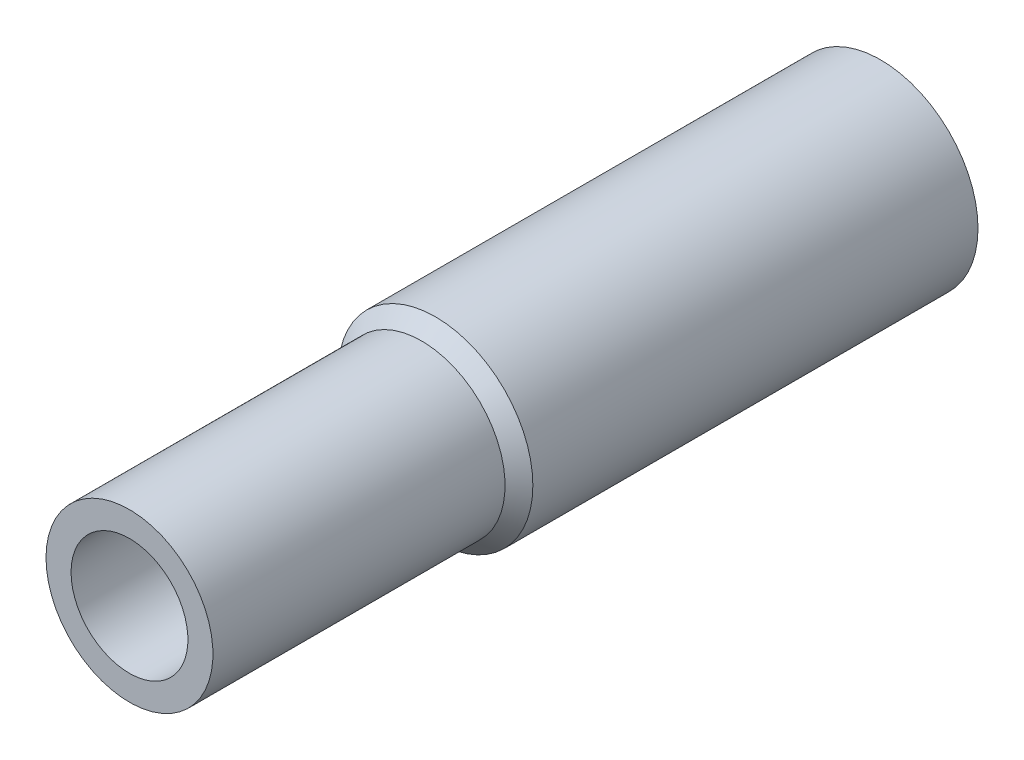
from build123d import *

# Parameters (mm, degrees)
SKETCH1_R                                       = 3.5
BOSS_EXTRUDE1_DEPTH                             = 16.5
CHAMFER1_SIZE                                   = 0.5
SKETCH2_R                                       = 3
BOSS_EXTRUDE2_DEPTH                             = 10.5
CSK_FOR_M4_FLAT_HEAD_MACHINE_SCREW1_D           = 4.2
CSK_FOR_M4_FLAT_HEAD_MACHINE_SCREW1_CSINK_D     = 5.5
CSK_FOR_M4_FLAT_HEAD_MACHINE_SCREW1_CSINK_ANGLE = 90


with BuildPart() as part:
    # Sketch1 → Boss-Extrude1 (new body)
    with BuildSketch(Plane.XY):
        Circle(SKETCH1_R)
    extrude(amount=BOSS_EXTRUDE1_DEPTH)

    # Chamfer1
    chamfer1_edges = [part.edges().sort_by_distance(p)[0] for p in [
        (-3.5, 0, 16.5),
    ]]
    chamfer(chamfer1_edges, length=CHAMFER1_SIZE)

    # Sketch2 → Boss-Extrude2 (add)
    with BuildSketch(Plane.XY.offset(16.5)):
        with Locations(Location((0, 0, 0), (0, 0, 180))):
            Circle(SKETCH2_R)
    extrude(amount=BOSS_EXTRUDE2_DEPTH)

    # CSK for M4 Flat Head Machine Screw1 (through all)
    with Locations(Plane(origin=(0, 0, 0), x_dir=(-1, 0, 0), z_dir=(0, 0, -1))):
        with Locations((0, 0)):
            CounterSinkHole(CSK_FOR_M4_FLAT_HEAD_MACHINE_SCREW1_D / 2, CSK_FOR_M4_FLAT_HEAD_MACHINE_SCREW1_CSINK_D / 2, counter_sink_angle=CSK_FOR_M4_FLAT_HEAD_MACHINE_SCREW1_CSINK_ANGLE)


solid = part.part
